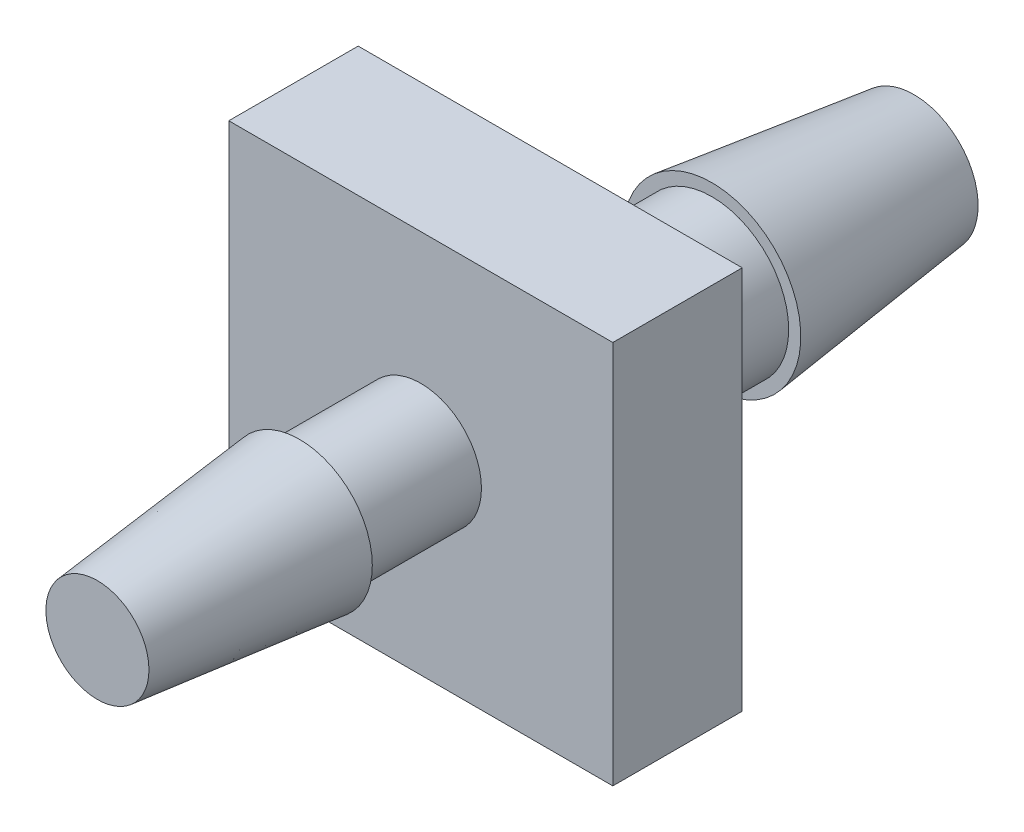
from build123d import *

# Parameters (mm, degrees)
ESQUISSE1_W      = 9.5
ESQUISSE1_H      = 9.5
EXTRUSION1_DEPTH = 3.2
ESQUISSE2_R      = 1.5
EXTRUSION2_DEPTH = 3
ESQUISSE3_R      = 1.8
EXTRUSION3_DEPTH = 5
EXTRUSION3_TAPER = 6
ESQUISSE4_R      = 1.9
EXTRUSION4_DEPTH = 4
ESQUISSE5_R      = 2.2
EXTRUSION5_DEPTH = 5
EXTRUSION5_TAPER = 7


with BuildPart() as part:
    # Esquisse1 → Extrusion1 (new body)
    with BuildSketch(Plane.XY):
        with Locations((-2.457587253, -3.276631259)):
            Rectangle(ESQUISSE1_W, ESQUISSE1_H)
    extrude(amount=EXTRUSION1_DEPTH)

    # Esquisse2 → Extrusion2 (add)
    with BuildSketch(Plane.XY.offset(3.2)):
        with Locations((-2.457587253, -3.276631259)):
            Circle(ESQUISSE2_R)
    extrude(amount=EXTRUSION2_DEPTH)

    # Esquisse3 → Extrusion3 (add)
    with BuildSketch(Plane.XY.offset(6.2)):
        with Locations((-2.457587253, -3.276631259)):
            Circle(ESQUISSE3_R)
    extrude(amount=EXTRUSION3_DEPTH, taper=EXTRUSION3_TAPER)

    # Esquisse4 → Extrusion4 (add)
    with BuildSketch(Plane(origin=(0, 0, 0), x_dir=(-1, 0, 0), z_dir=(0, 0, -1))):
        with Locations(Location((2.457587253, -3.276631259, 0), (0, 0, 180))):
            Circle(ESQUISSE4_R)
    extrude(amount=EXTRUSION4_DEPTH)

    # Esquisse5 → Extrusion5 (add)
    with BuildSketch(Plane(origin=(0, 0, -4), x_dir=(-1, 0, 0), z_dir=(0, 0, -1))):
        with Locations((2.457587253, -3.276631259)):
            Circle(ESQUISSE5_R)
    extrude(amount=EXTRUSION5_DEPTH, taper=EXTRUSION5_TAPER)


solid = part.part
